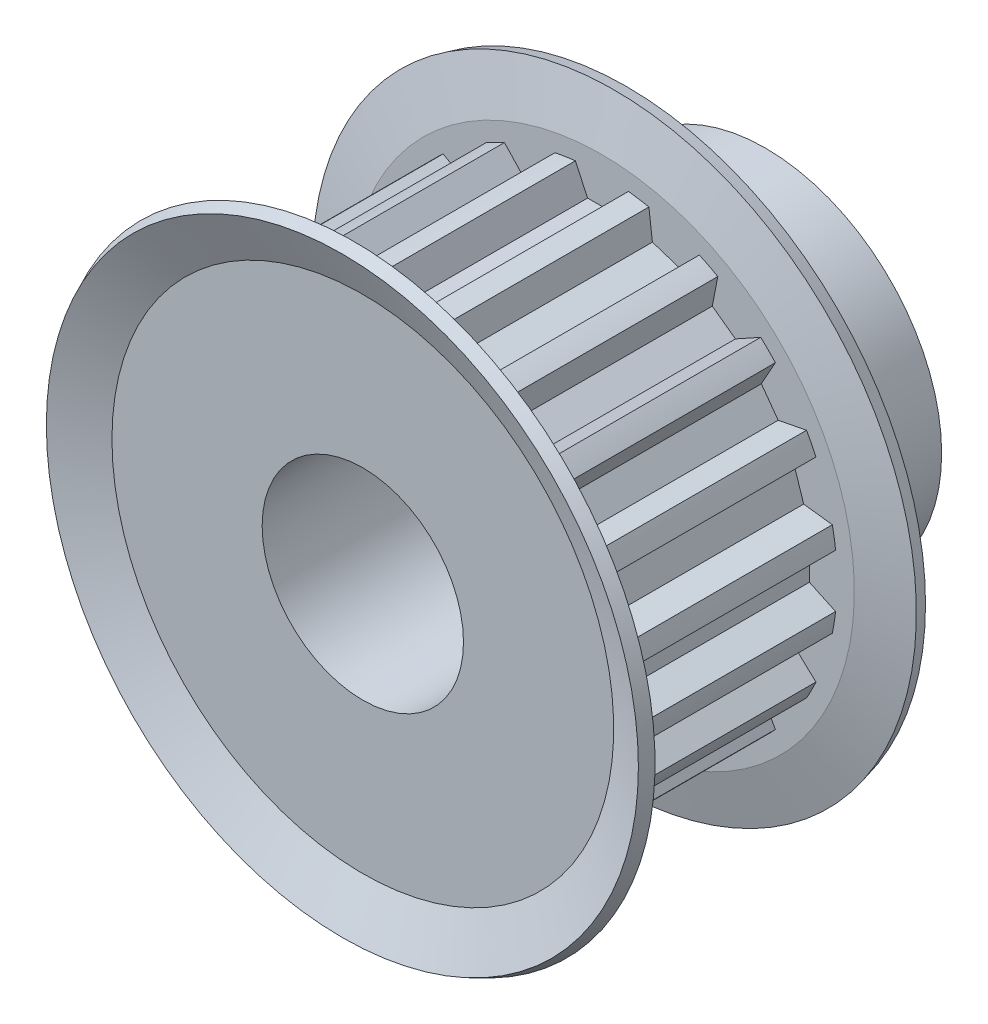
from build123d import *

# Parameters (mm, degrees)
ESQUISSE1_R                  = 9.345000000000002
EXTRUSION1_DEPTH             = 10
EXTRUSION2_DEPTH             = 17.572810564294763
R_P_TITION_CIRCULAIRE1_COUNT = 20
ESQUISSE4_R                  = 4
EXTRUSION3_DEPTH             = 17.50568653417299


with BuildPart() as part:
    # Esquisse1 → Extrusion1 (new body)
    with BuildSketch(Plane.XY):
        Circle(ESQUISSE1_R)
    extrude(amount=EXTRUSION1_DEPTH)

    # Esquisse2 → Extrusion2 (cut, through all)
    with BuildSketch(Plane.XY.offset(10)):
        Polygon((-0.5685000000000011, 8.245), (0.5684999999999989, 8.245), (1.2888044910509866, 9.789697965932955), (-1.2888044910509753, 9.789697965932955), align=None)
    extrusion2 = extrude(amount=-EXTRUSION2_DEPTH, mode=Mode.SUBTRACT)

    # Répétition circulaire1: Extrusion2 ×20 about axis
    r_p_tition_circulaire1_axis = Axis((3e-17, -4.2e-16, 0), (0, 0, 1))
    for i in range(1, R_P_TITION_CIRCULAIRE1_COUNT):
        add(extrusion2.rotate(r_p_tition_circulaire1_axis, i * 360 / R_P_TITION_CIRCULAIRE1_COUNT), mode=Mode.SUBTRACT)

    # Esquisse4 → Extrusion3 (cut, through all)
    with BuildSketch(Plane.XY.offset(10)):
        Circle(ESQUISSE4_R)
    extrude(amount=-EXTRUSION3_DEPTH, mode=Mode.SUBTRACT)

    # Esquisse5 → Révolution1 (revolve)
    with BuildSketch(Plane(origin=(0, 0, 0), x_dir=(0, 0, -1), z_dir=(1, 0, 0)), mode=Mode.PRIVATE) as r_volution1_sk:
        Polygon((-10, 8), (-10, 9.969000000000001), (-10.812476697134908, 11.762555858236022), (-10.357028282143537, 11.96887294740182), (-9.479176274054629, 10.031), (-9.479176274054645, 8), align=None)
        Polygon((0, 8), (-5.9e-16, 9.969000000000001), (0.48091741384473186, 11.878366240683253), (-0.00393942736482848, 12.00048848899324), (-0.5, 10.031), (-0.4999999999999998, 8), align=None)
        Polygon((0, 7), (6, 6.999999999999999), (6.000000000000001, 4), (4.6e-16, 4), align=None)
    revolve(r_volution1_sk.sketch.rotate(Axis((0, 0, -0.6503339320090771), (0, 0, 1)), 90), axis=Axis((0, 0, -0.6503339320090771), (0, 0, 1)))


solid = part.part
